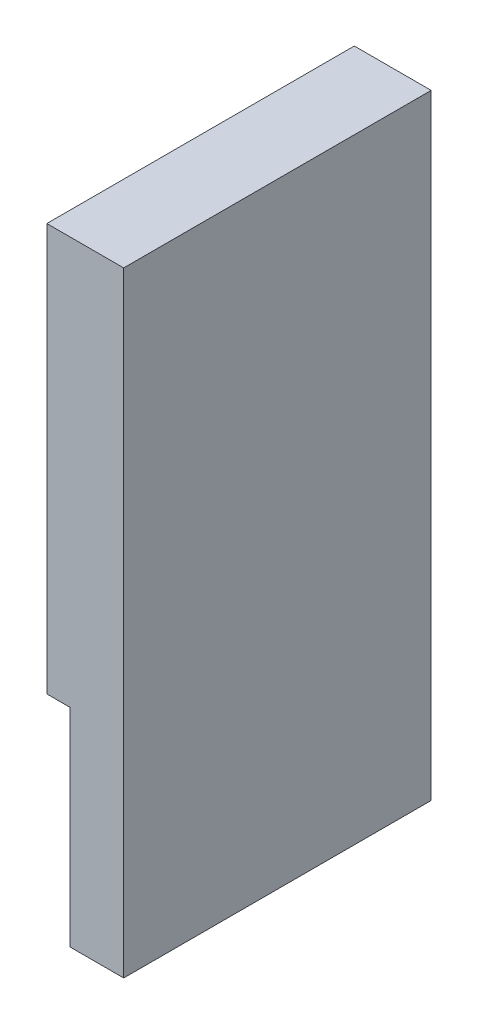
from build123d import *

# Parameters (mm, degrees)
SKETCH1_W           = 40
SKETCH1_H           = 80
BOSS_EXTRUDE1_DEPTH = 10
SKETCH2_W           = 40
SKETCH2_H           = 27
CUT_EXTRUDE1_DEPTH  = 3


with BuildPart() as part:
    # Sketch1 → Boss-Extrude1 (new body)
    with BuildSketch(Plane(origin=(0, 0, 0), x_dir=(0, 0, -1), z_dir=(1, 0, 0))):
        with Locations((20, 41.83908046)):
            Rectangle(SKETCH1_W, SKETCH1_H)
    extrude(amount=BOSS_EXTRUDE1_DEPTH)

    # Sketch2 → Cut-Extrude1 (cut)
    with BuildSketch(Plane.ZY):
        with Locations((-20, 15.33908046)):
            Rectangle(SKETCH2_W, SKETCH2_H)
    extrude(amount=-CUT_EXTRUDE1_DEPTH, mode=Mode.SUBTRACT)


solid = part.part
